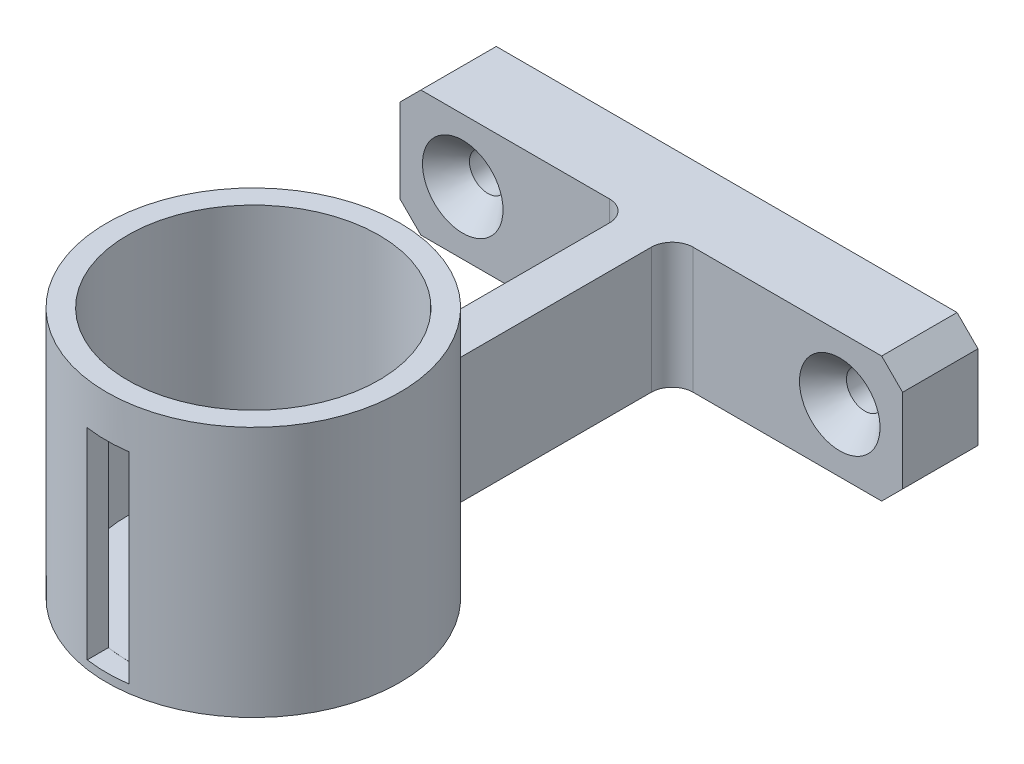
from build123d import *

# Parameters (mm, degrees)
SKETCH1_W           = 60
SKETCH1_H           = 15
SKETCH1_R           = 2.2
BOSS_EXTRUDE1_DEPTH = 9
SKETCH4_W           = 5
SKETCH4_H           = 15
BOSS_EXTRUDE2_DEPTH = 51
SKETCH5_R           = 17.5
BOSS_EXTRUDE3_DEPTH = 30
SKETCH6_R           = 15
CUT_EXTRUDE1_DEPTH  = 100.879927913
FILLET1_R           = 2.5
CHAMFER1_SIZE       = 2.5
SKETCH7_R           = 15
SKETCH7_R_2         = 1.5
BOSS_EXTRUDE4_DEPTH = 1
SKETCH8_W           = 5
SKETCH8_H           = 5.5
CUT_EXTRUDE2_DEPTH  = 24


with BuildPart() as part:
    # Sketch1 → Boss-Extrude1 (new body)
    with BuildSketch(Plane.XY):
        with Locations((30, -7.5)):
            Rectangle(SKETCH1_W, SKETCH1_H)
        with Locations((7.5, -7.5)):
            Circle(SKETCH1_R, mode=Mode.SUBTRACT)
        with Locations(Location((52.5, -7.5, 0), (0, 0, 180))):
            Circle(SKETCH1_R, mode=Mode.SUBTRACT)
    extrude(amount=BOSS_EXTRUDE1_DEPTH)

    # Sketch3 → Cut-Revolve1 (revolve, cut)
    with BuildSketch(Plane(origin=(7.5, 0, 0), x_dir=(0, 0, -1), z_dir=(1, 0, 0)), mode=Mode.PRIVATE) as cut_revolve1_sk:
        Polygon((-9, -7.5), (-6, -7.5), (-6, -9.7), (-9, -12.307860213), align=None)
    cut_revolve1 = revolve(cut_revolve1_sk.sketch.rotate(Axis((7.5, -7.5, 9), (0, 0, -1)), 270), axis=Axis((7.5, -7.5, 9), (0, 0, -1)), mode=Mode.SUBTRACT)

    # Mirror1: Cut-Revolve1 across plane
    add(cut_revolve1.mirror(Plane(origin=(30, 0, 0), x_dir=(0, 0, 1), z_dir=(1, 0, 0))), mode=Mode.SUBTRACT)

    # Sketch4 → Boss-Extrude2 (add)
    with BuildSketch(Plane.XY.offset(9)):
        with Locations((30, -7.5)):
            Rectangle(SKETCH4_W, SKETCH4_H)
    extrude(amount=BOSS_EXTRUDE2_DEPTH)

    # Sketch5 → Boss-Extrude3 (add)
    with BuildSketch(Plane.XZ.offset(15)):
        with Locations(Location((30, 56.5, 0), (0, 0, 270))):
            Circle(SKETCH5_R)
    extrude(amount=-BOSS_EXTRUDE3_DEPTH)

    # Sketch6 → Cut-Extrude1 (cut, through all)
    with BuildSketch(Plane.XZ.offset(15)):
        with Locations(Location((30, 56.5, 0), (0, 0, 270))):
            Circle(SKETCH6_R)
    extrude(amount=-CUT_EXTRUDE1_DEPTH, mode=Mode.SUBTRACT)

    # Fillet1
    fillet1_edges = [part.edges().sort_by_distance(p)[0] for p in [
        (32.5, -7.5, 9),
        (27.5, -7.5, 9),
        (27.5, -7.5, 39.179491924),
        (32.5, -7.5, 39.179491924),
    ]]
    fillet(fillet1_edges, radius=FILLET1_R)

    # Chamfer1
    chamfer1_edges = [part.edges().sort_by_distance(p)[0] for p in [
        (0, 0, 4.5),
        (60, 0, 4.5),
        (60, -15, 4.5),
        (0, -15, 4.5),
    ]]
    chamfer(chamfer1_edges, length=CHAMFER1_SIZE)

    # Sketch8 → Cut-Extrude2 (cut)
    with BuildSketch(Plane.XZ.offset(14)):
        with Locations((30, 74.040199458)):
            Rectangle(SKETCH8_W, SKETCH8_H)
    extrude(amount=-CUT_EXTRUDE2_DEPTH, mode=Mode.SUBTRACT)


with BuildPart() as body_2:
    # Sketch7 → Boss-Extrude4 (new body)
    with BuildSketch(Plane.XZ.offset(15)):
        with Locations(Location((30, 56.5, 0), (0, 0, 270))):
            Circle(SKETCH7_R)
        with Locations(Location((30, 56.5, 0), (0, 0, 270))):
            Circle(SKETCH7_R_2, mode=Mode.SUBTRACT)
    extrude(amount=-BOSS_EXTRUDE4_DEPTH)


solid = Compound([part.part, body_2.part])
